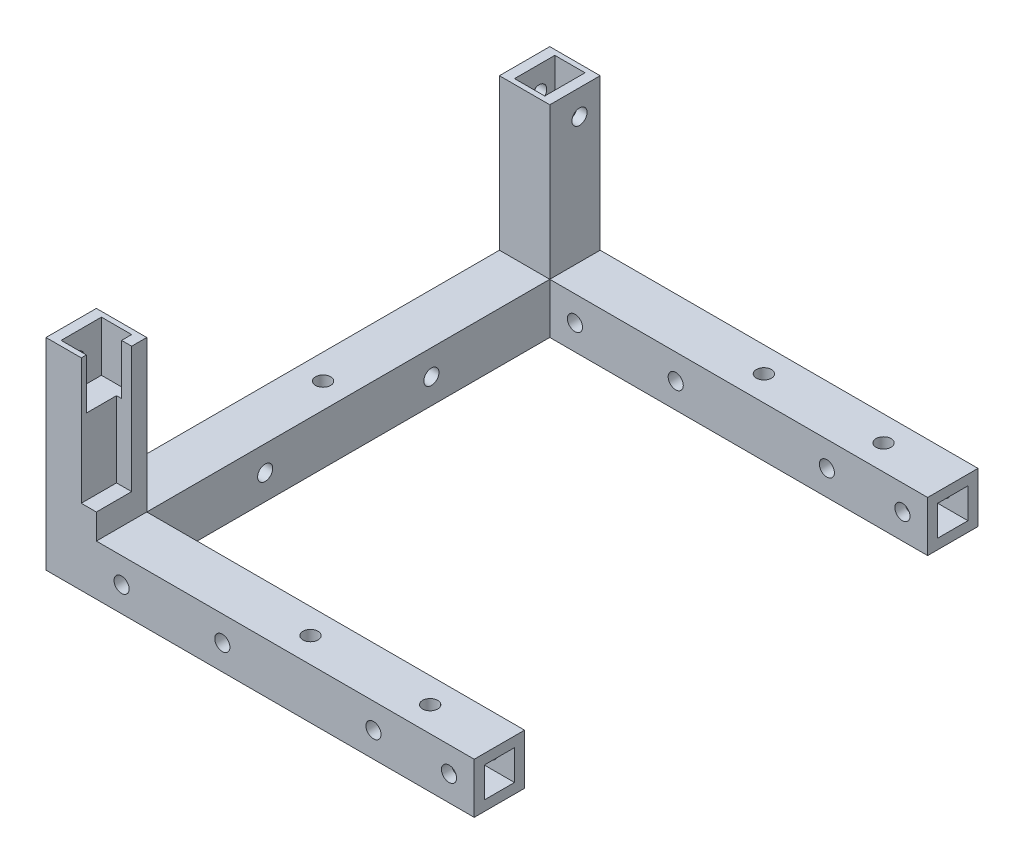
from build123d import *

# Parameters (mm, degrees)
SKETCH1_W               = 320
SKETCH1_H               = 200
SKETCH1_W_2             = 280
SKETCH1_H_2             = 160
BOSS_EXTRUDE1_DEPTH     = 20
SKETCH2_W               = 150
SKETCH2_H               = 200
CUT_EXTRUDE1_DEPTH      = 20
SKETCH3_W               = 20
SKETCH3_H               = 20
BOSS_EXTRUDE2_DEPTH     = 60
SKETCH4_W               = 12
SKETCH4_H               = 16
CUT_EXTRUDE2_DEPTH      = 20
SKETCH5_W               = 12
SKETCH5_H               = 12
CUT_EXTRUDE3_DEPTH      = 22
CUT_EXTRUDE5_DEPTH      = 275.40845468
CUT_EXTRUDE5_DEPTH_BACK = 275.40845468
SKETCH8_R               = 3
SKETCH10_R              = 3
CUT_EXTRUDE6_DEPTH      = 30
SKETCH11_W              = 14
SKETCH11_H              = 50
CUT_EXTRUDE7_DEPTH      = 6
SKETCH12_R              = 3
CUT_EXTRUDE8_DEPTH      = 26
SKETCH13_R              = 3
CUT_EXTRUDE9_DEPTH      = 26


with BuildPart() as part:
    # Sketch1 → Boss-Extrude1 (new body)
    with BuildSketch(Plane(origin=(0, 0, 0), x_dir=(1, 0, 0), z_dir=(0, 1, 0))):
        with Locations((160, 100)):
            Rectangle(SKETCH1_W, SKETCH1_H)
        with Locations((160, 100)):
            Rectangle(SKETCH1_W_2, SKETCH1_H_2, mode=Mode.SUBTRACT)
    extrude(amount=BOSS_EXTRUDE1_DEPTH)

    # Sketch2 → Cut-Extrude1 (cut)
    with BuildSketch(Plane(origin=(0, 20, 0), x_dir=(1, 0, 0), z_dir=(0, 1, 0))):
        with Locations((245, 100)):
            Rectangle(SKETCH2_W, SKETCH2_H)
    extrude(amount=-CUT_EXTRUDE1_DEPTH, mode=Mode.SUBTRACT)

    # Sketch3 → Boss-Extrude2 (add)
    with BuildSketch(Plane(origin=(0, 20, 0), x_dir=(1, 0, 0), z_dir=(0, 1, 0))):
        with Locations((10, 10)):
            Rectangle(SKETCH3_W, SKETCH3_H)
        with Locations((10, 190)):
            Rectangle(SKETCH3_W, SKETCH3_H)
    extrude(amount=BOSS_EXTRUDE2_DEPTH)

    # Sketch4 → Cut-Extrude2 (cut)
    with BuildSketch(Plane(origin=(0, 80, 0), x_dir=(1, 0, 0), z_dir=(0, 1, 0))):
        with Locations((10, 10)):
            Rectangle(SKETCH4_W, SKETCH4_H)
        with Locations((10, 190)):
            Rectangle(SKETCH4_W, SKETCH4_H)
    extrude(amount=-CUT_EXTRUDE2_DEPTH, mode=Mode.SUBTRACT)

    # Sketch5 → Cut-Extrude3 (cut)
    with BuildSketch(Plane(origin=(170, 0, 0), x_dir=(0, 0, -1), z_dir=(1, 0, 0))):
        with Locations((10, 10)):
            Rectangle(SKETCH5_W, SKETCH5_H)
        with Locations((190, 10)):
            Rectangle(SKETCH5_W, SKETCH5_H)
    extrude(amount=-CUT_EXTRUDE3_DEPTH, mode=Mode.SUBTRACT)

    # Sketch8 → Cut-Extrude5 (cut, two sides: drawn at the far end of the back side and taken through both)
    with BuildSketch(Plane(origin=(0, 0, -200), x_dir=(-1, 0, 0), z_dir=(0, 0, -1)).offset(-CUT_EXTRUDE5_DEPTH_BACK)):
        with Locations((-30, 10)):
            Circle(SKETCH8_R)
        with Locations((-160, 10)):
            Circle(SKETCH8_R)
        with Locations((-70, 10)):
            Circle(SKETCH8_R)
        with Locations((-130, 10)):
            Circle(SKETCH8_R)
    extrude(amount=CUT_EXTRUDE5_DEPTH + CUT_EXTRUDE5_DEPTH_BACK, mode=Mode.SUBTRACT)

    # Sketch10 → Cut-Extrude6 (cut)
    with BuildSketch(Plane.XZ):
        with Locations(Location((142.5, -10, 0), (0, 0, 270))):
            Circle(SKETCH10_R)
        with Locations(Location((95, -10, 0), (0, 0, 270))):
            Circle(SKETCH10_R)
        with Locations(Location((10, -100, 0), (0, 0, 270))):
            Circle(SKETCH10_R)
        with Locations(Location((142.5, -190, 0), (0, 0, 270))):
            Circle(SKETCH10_R)
        with Locations(Location((95, -190, 0), (0, 0, 270))):
            Circle(SKETCH10_R)
    extrude(amount=-CUT_EXTRUDE6_DEPTH, mode=Mode.SUBTRACT)

    # Sketch11 → Cut-Extrude7 (cut)
    with BuildSketch(Plane(origin=(20, 0, 0), x_dir=(0, 0, -1), z_dir=(1, 0, 0))):
        with Locations((7, 55)):
            Rectangle(SKETCH11_W, SKETCH11_H)
    extrude(amount=-CUT_EXTRUDE7_DEPTH, mode=Mode.SUBTRACT)

    # Sketch12 → Cut-Extrude8 (cut)
    with BuildSketch(Plane.ZY):
        with Locations((-133, 10)):
            Circle(SKETCH12_R)
        with Locations((-67, 10)):
            Circle(SKETCH12_R)
    extrude(amount=-CUT_EXTRUDE8_DEPTH, mode=Mode.SUBTRACT)

    # Sketch13 → Cut-Extrude9 (cut)
    with BuildSketch(Plane.ZY):
        with Locations((-191.8, 70)):
            Circle(SKETCH13_R)
        with Locations((-8.2, 70)):
            Circle(SKETCH13_R)
    extrude(amount=-CUT_EXTRUDE9_DEPTH, mode=Mode.SUBTRACT)


solid = part.part
